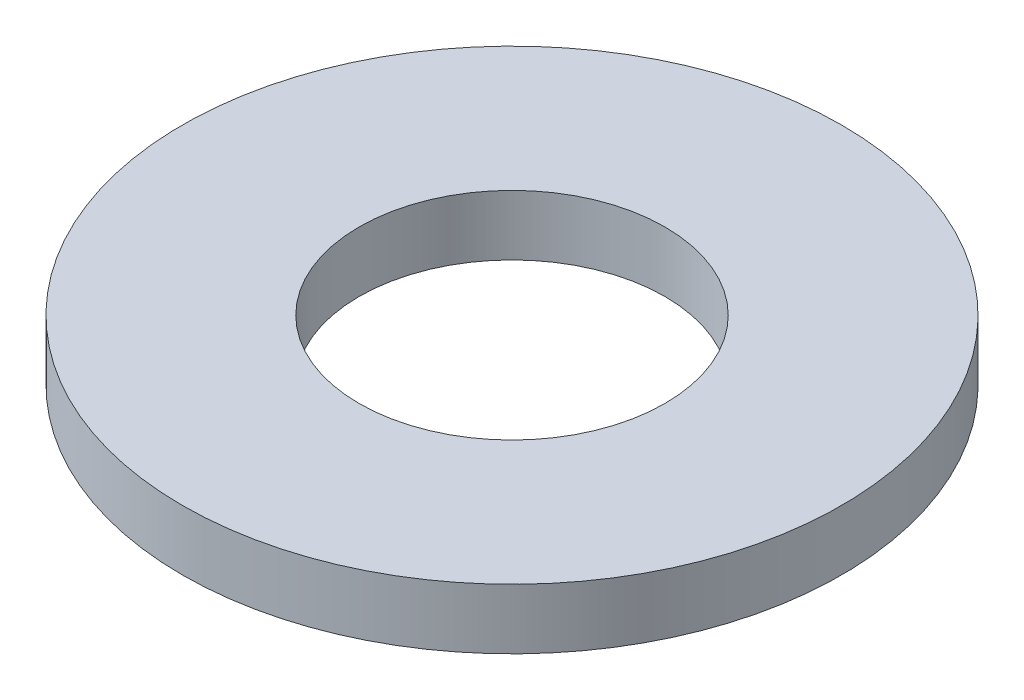
from build123d import *

# Parameters (mm, degrees)
SKETCH1_R           = 5.55625
BOSS_EXTRUDE1_DEPTH = 1.016
SKETCH5_R           = 2.5781
CUT_EXTRUDE1_DEPTH  = 8.923136003


with BuildPart() as part:
    # Sketch1 → Boss-Extrude1 (new body)
    with BuildSketch(Plane(origin=(0, 0, 0), x_dir=(1, 0, 0), z_dir=(0, 1, 0))):
        with Locations(Location((0, 0, 0), (0, 0, 270))):
            Circle(SKETCH1_R)
    extrude(amount=BOSS_EXTRUDE1_DEPTH)

    # Sketch5 → Cut-Extrude1 (cut, through all)
    with BuildSketch(Plane(origin=(0, 1.016, 0), x_dir=(-1, 0, 0), z_dir=(0, 1, 0))):
        with Locations(Location((0, 0, 0), (0, 0, 90))):
            Circle(SKETCH5_R)
    extrude(amount=-CUT_EXTRUDE1_DEPTH, mode=Mode.SUBTRACT)


solid = part.part
